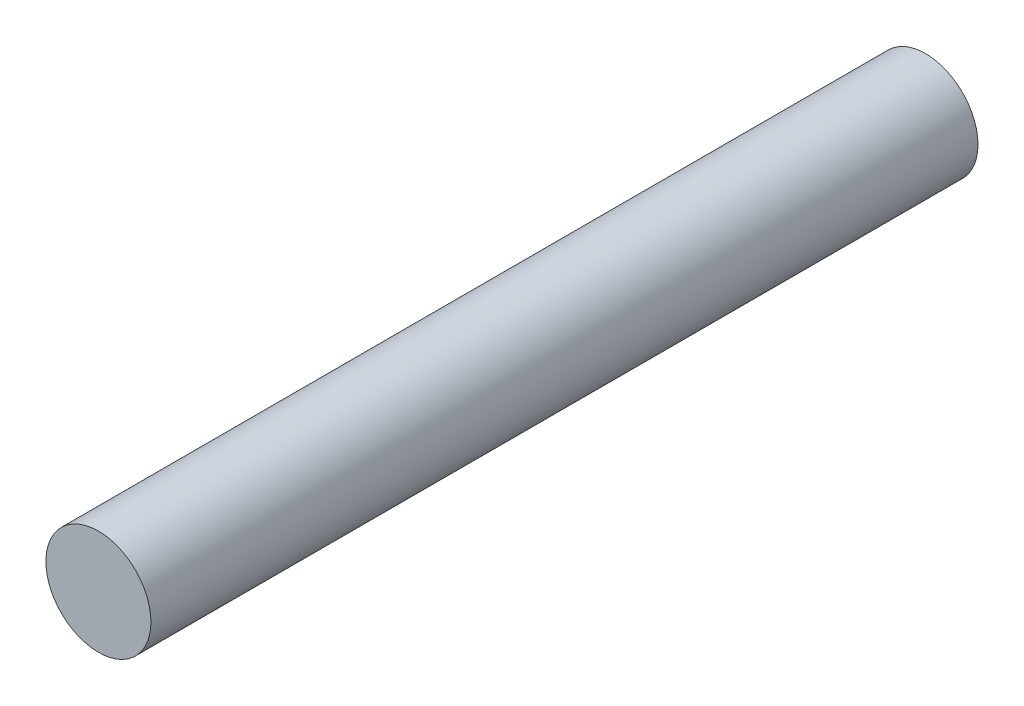
from build123d import *

# Parameters (mm, degrees)
CROQUIS1_R              = 3.175
SALIENTE_EXTRUIR1_DEPTH = 25


with BuildPart() as part:
    # Croquis1 → Saliente-Extruir1 (new, symmetric)
    with BuildSketch(Plane.XY):
        Circle(CROQUIS1_R)
    extrude(amount=SALIENTE_EXTRUIR1_DEPTH, both=True)


solid = part.part
